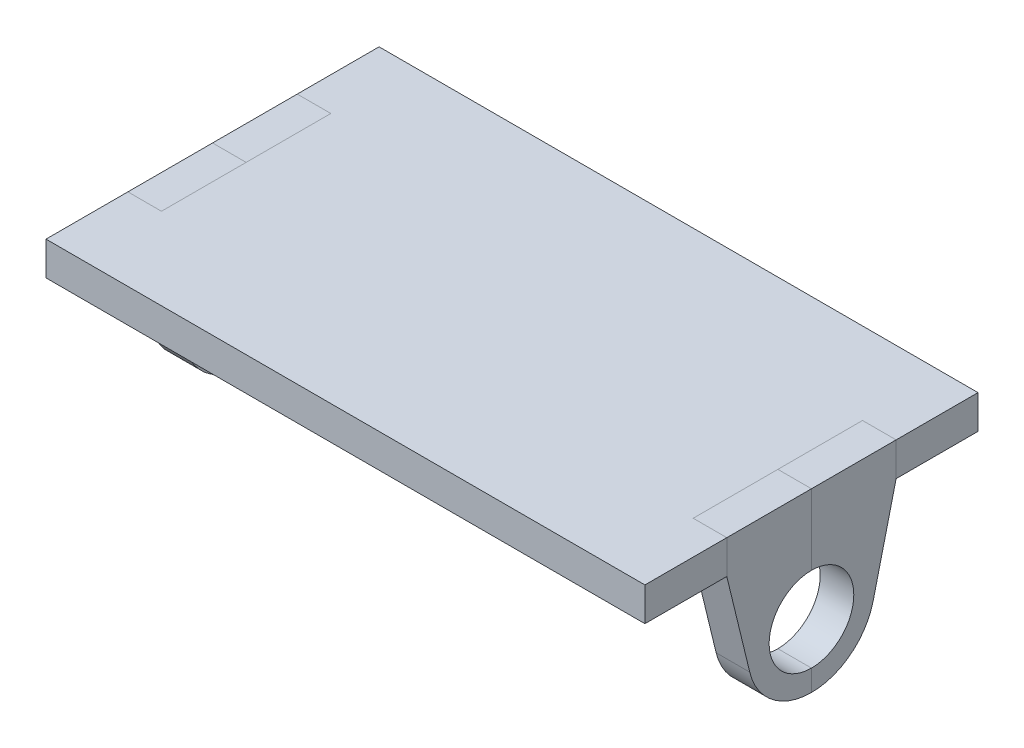
from build123d import *

# Parameters (mm, degrees)
EXTRUDE_1_DEPTH     = 6.35
SKETCH_4_W          = 12.7
SKETCH_4_H          = 32
CUT_EXTRUDE_1_DEPTH = 16.35
EXTRUDE_2_DEPTH     = 6.35


with BuildPart() as part:
    # 草图1 → 凸台-拉伸1 (new body)
    with BuildSketch(Plane(origin=(0, 0, 0), x_dir=(1, 0, 0), z_dir=(0, 1, 0))):
        Polygon((-3.175, 0), (0, 0), (35, 0), (41.35, 0), (95, 0), (95, 62.94), (41.35, 62.94), (35, 62.94), (0, 62.94), (-3.175, 62.94), (-18.175, 62.94), (-18.175, 0), align=None)
    extrude(amount=EXTRUDE_1_DEPTH)

    # 草图4 → 切除-拉伸1 (cut)
    with BuildSketch(Plane(origin=(0, 6.35, 0), x_dir=(1, 0, 0), z_dir=(0, 1, 0))):
        with Locations((-18.175, 31.47)):
            Rectangle(SKETCH_4_W, SKETCH_4_H)
        with Locations((95, 31.47)):
            Rectangle(SKETCH_4_W, SKETCH_4_H)
    extrude(amount=-CUT_EXTRUDE_1_DEPTH, mode=Mode.SUBTRACT)


with BuildPart() as body_2:
    # 草图5 → 凸台-拉伸2 (new body)
    with BuildSketch(Plane(origin=(95, 0, 0), x_dir=(0, 0, -1), z_dir=(1, 0, 0))):
        with BuildLine():
            Line((15.47, 6.35), (15.47, 0))
            Line((15.47, 0), (19.81020633, -17.837113248))
            ThreePointArc((19.81020633, -17.837113248), (24.055330721, -24.435183066), (31.47, -27))
            Line((31.47, -27), (31.47, -23))
            ThreePointArc((31.47, -23), (23.47, -15), (31.47, -7))
            Line((31.47, -7), (31.47, 6.35))
            Line((31.47, 6.35), (15.47, 6.35))
        make_face()
    extrude(amount=-EXTRUDE_2_DEPTH)


with BuildPart() as body_3:
    # 镜向1: mirrored copy
    add(body_2.part.mirror(Plane.ZY.offset(-38.4125)))


with BuildPart() as body_4:
    # 镜向2: mirrored copy
    add(body_2.part.mirror(Plane(origin=(25.164491751, 0, -31.47), x_dir=(1, 0, 0), z_dir=(0, 0, -1))))


with BuildPart() as body_5:
    # Mirror 2 2: mirrored copy
    add(body_3.part.mirror(Plane(origin=(25.164491751, 0, -31.47), x_dir=(1, 0, 0), z_dir=(0, 0, -1))))


solid = Compound([part.part, body_2.part, body_3.part, body_4.part, body_5.part])
